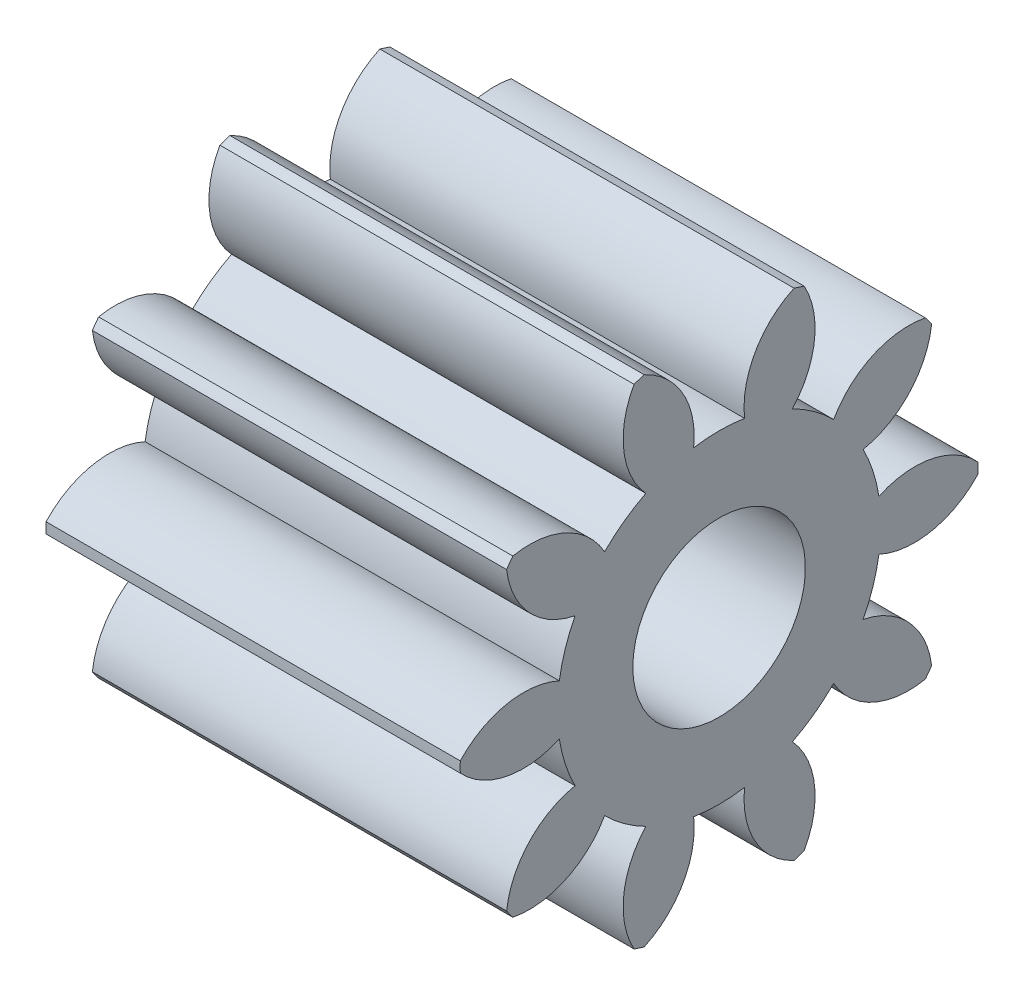
from build123d import *

# Parameters (mm, degrees)
BASPROSKE_W     = 12
BASPROSKE_H     = 7.5
TOOTHCUT_DEPTH  = 17.015617378
TEETHCUTS_COUNT = 10
BORSKE_R        = 2.5
BORE_DEPTH      = 50.0000508


with BuildPart() as part:
    # BasProSke → Base-Revolve (revolve)
    with BuildSketch(Plane(origin=(0, 0, 0), x_dir=(1, 0, 0), z_dir=(0, 1, 0)), mode=Mode.PRIVATE) as base_revolve_sk:
        with Locations((6, 3.75)):
            Rectangle(BASPROSKE_W, BASPROSKE_H)
    revolve(base_revolve_sk.sketch.rotate(Axis((-10, 0, 0), (1, 0, 0)), 180), axis=Axis((-10, 0, 0), (1, 0, 0)))

    # TooCutSke → ToothCut (cut, through all)
    with BuildSketch(Plane(origin=(0, 0, 0), x_dir=(0, 0, -1), z_dir=(1, 0, 0))):
        with BuildLine():
            ThreePointArc((0.737676151, 4.628079099), (0, 4.6865), (-0.737676151, 4.628079099))
            ThreePointArc((-0.737676151, 4.628079099), (-1.051542781, 6.151798382), (-2.205760267, 7.194877817))
            ThreePointArc((-2.205760267, 7.194877817), (0, 7.5254), (2.205760267, 7.194877817))
            ThreePointArc((2.205760267, 7.194877817), (1.051542781, 6.151798382), (0.737676151, 4.628079099))
        make_face()
    toothcut = extrude(amount=TOOTHCUT_DEPTH, mode=Mode.SUBTRACT)

    # TeethCuts: ToothCut ×10 about axis
    teethcuts_axis = Axis((0, 0, 0), (1, 0, 0))
    for i in range(1, TEETHCUTS_COUNT):
        add(toothcut.rotate(teethcuts_axis, i * 360 / TEETHCUTS_COUNT), mode=Mode.SUBTRACT)

    # BorSke → Bore (cut, symmetric)
    with BuildSketch(Plane(origin=(0, 0, 0), x_dir=(0, 0, -1), z_dir=(1, 0, 0))):
        with Locations(Location((0, 0, 0), (0, 0, 180))):
            Circle(BORSKE_R)
    extrude(amount=BORE_DEPTH, both=True, mode=Mode.SUBTRACT)


solid = part.part
